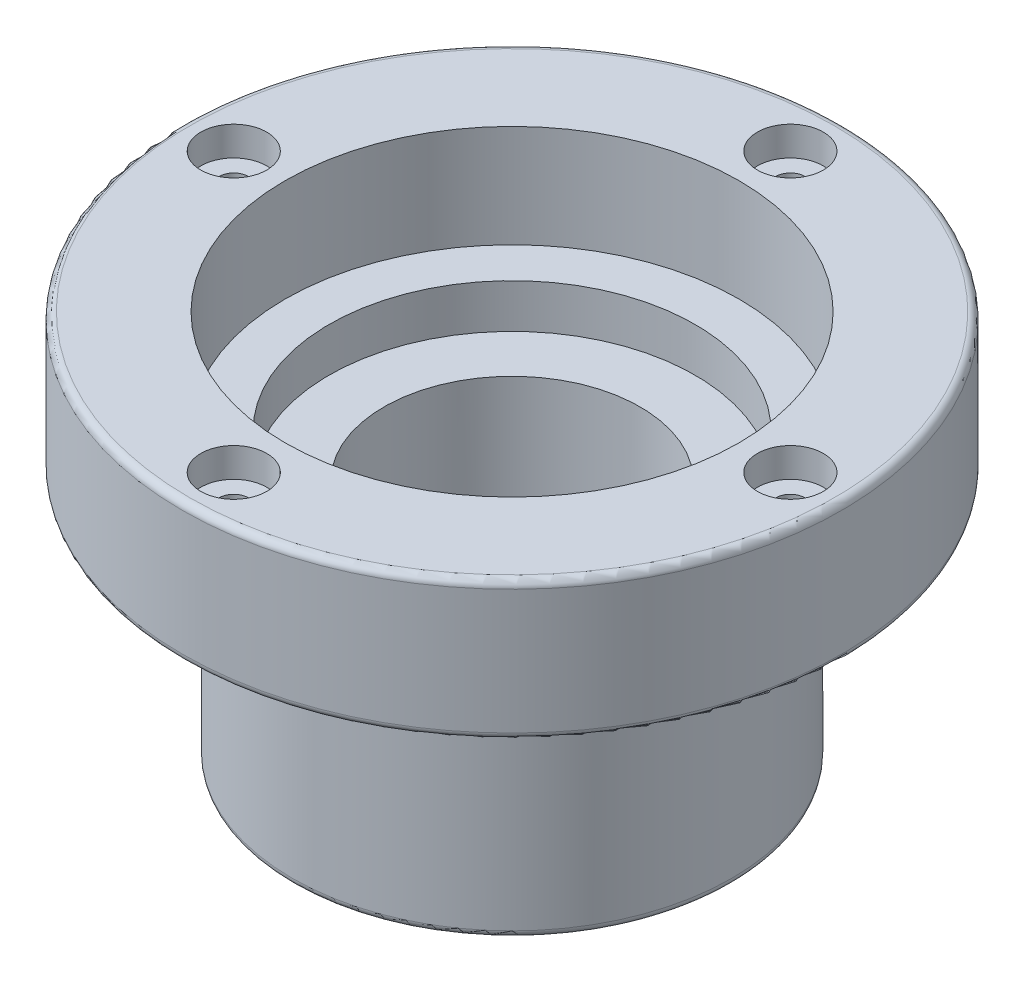
from build123d import *

# Parameters (mm, degrees)
SKETCH_1_R               = 45
EXTRUDE_2_DEPTH          = 19
SKETCH_3_R               = 30
EXTRUDE_3_DEPTH          = 34
SKETCH_8_R               = 23.5
CUT_EXTRUDE_2_DEPTH      = 14
SKETCH_9_R               = 31
CUT_EXTRUDE_4_DEPTH      = 14
SKETCH_11_R              = 25
CUT_EXTRUDE_6_DEPTH      = 6
SKETCH_12_R              = 17.5
CUT_EXTRUDE_7_DEPTH      = 60
SKETCH_14_R              = 2
CUT_EXTRUDE_8_DEPTH      = 20
PATTERN_CIRCULAR_1_COUNT = 4
SKETCH_15_R              = 1.5
CUT_EXTRUDE_9_DEPTH      = 12
PATTERN_CIRCULAR_2_COUNT = 4
FILLET_1_R               = 1
SKETCH_16_R              = 4.5
CUT_EXTRUDE_10_DEPTH     = 4
PATTERN_CIRCULAR_3_COUNT = 4


with BuildPart() as part:
    # 草图1 → 凸台-拉伸2 (new body)
    with BuildSketch(Plane(origin=(0, 0, 0), x_dir=(1, 0, 0), z_dir=(0, 1, 0))):
        with Locations(Location((0, 0, 0), (0, 0, 270))):
            Circle(SKETCH_1_R)
    extrude(amount=-EXTRUDE_2_DEPTH)

    # 草图3 → 凸台-拉伸3 (add)
    with BuildSketch(Plane.XZ.offset(19)):
        with Locations(Location((0, 0, 0), (0, 0, 270))):
            Circle(SKETCH_3_R)
    extrude(amount=EXTRUDE_3_DEPTH)

    # 草图8 → 切除-拉伸2 (cut)
    with BuildSketch(Plane.XZ.offset(53)):
        with Locations(Location((0, 0, 0), (0, 0, 270))):
            Circle(SKETCH_8_R)
    extrude(amount=-CUT_EXTRUDE_2_DEPTH, mode=Mode.SUBTRACT)

    # 草图9 → 切除-拉伸4 (cut)
    with BuildSketch(Plane(origin=(0, 0, 0), x_dir=(1, 0, 0), z_dir=(0, 1, 0))):
        with Locations(Location((0, 0, 0), (0, 0, 270))):
            Circle(SKETCH_9_R)
    extrude(amount=-CUT_EXTRUDE_4_DEPTH, mode=Mode.SUBTRACT)

    # 草图11 → 切除-拉伸6 (cut)
    with BuildSketch(Plane(origin=(0, -14, 0), x_dir=(1, 0, 0), z_dir=(0, 1, 0))):
        with Locations(Location((0, 0, 0), (0, 0, 270))):
            Circle(SKETCH_11_R)
    extrude(amount=-CUT_EXTRUDE_6_DEPTH, mode=Mode.SUBTRACT)

    # 草图12 → 切除-拉伸7 (cut)
    with BuildSketch(Plane(origin=(0, -20, 0), x_dir=(1, 0, 0), z_dir=(0, 1, 0))):
        with Locations(Location((0, 0, 0), (0, 0, 270))):
            Circle(SKETCH_12_R)
    extrude(amount=-CUT_EXTRUDE_7_DEPTH, mode=Mode.SUBTRACT)

    # 草图14 → 切除-拉伸8 (cut)
    with BuildSketch(Plane(origin=(0, 0, 0), x_dir=(1, 0, 0), z_dir=(0, 1, 0))):
        with Locations(Location((0, 38, 0), (0, 0, 270))):
            Circle(SKETCH_14_R)
    cut_extrude_8 = extrude(amount=-CUT_EXTRUDE_8_DEPTH, mode=Mode.SUBTRACT)

    # 阵列(圆周)1: 切除-拉伸8 ×4 about axis
    pattern_circular_1_axis = Axis((0, 0, 0), (0, 1, 0))
    for i in range(1, PATTERN_CIRCULAR_1_COUNT):
        add(cut_extrude_8.rotate(pattern_circular_1_axis, i * 360 / PATTERN_CIRCULAR_1_COUNT), mode=Mode.SUBTRACT)

    # 草图15 → 切除-拉伸9 (cut)
    with BuildSketch(Plane.XZ.offset(53)):
        with Locations(Location((0, 27, 0), (0, 0, 270))):
            Circle(SKETCH_15_R)
    cut_extrude_9 = extrude(amount=-CUT_EXTRUDE_9_DEPTH, mode=Mode.SUBTRACT)

    # 阵列(圆周)2: 切除-拉伸9 ×4 about axis
    pattern_circular_2_axis = Axis((0, 0, 0), (0, 1, 0))
    for i in range(1, PATTERN_CIRCULAR_2_COUNT):
        add(cut_extrude_9.rotate(pattern_circular_2_axis, i * 360 / PATTERN_CIRCULAR_2_COUNT), mode=Mode.SUBTRACT)

    # 圆角1
    fillet_1_edges = [part.edges().sort_by_distance(p)[0] for p in [
        (0, 0, -45),
        (0, -19, -45),
        (0, -19, 30),
        (0, -53, 30),
    ]]
    fillet(fillet_1_edges, radius=FILLET_1_R)

    # 草图16 → 切除-拉伸10 (cut)
    with BuildSketch(Plane(origin=(0, 0, 0), x_dir=(1, 0, 0), z_dir=(0, 1, 0))):
        with Locations(Location((-38, 0, 0), (0, 0, 270))):
            Circle(SKETCH_16_R)
    cut_extrude_10 = extrude(amount=-CUT_EXTRUDE_10_DEPTH, mode=Mode.SUBTRACT)

    # 阵列(圆周)3: 切除-拉伸10 ×4 about axis
    pattern_circular_3_axis = Axis((0, 0, 0), (0, 1, 0))
    for i in range(1, PATTERN_CIRCULAR_3_COUNT):
        add(cut_extrude_10.rotate(pattern_circular_3_axis, i * 360 / PATTERN_CIRCULAR_3_COUNT), mode=Mode.SUBTRACT)


solid = part.part
